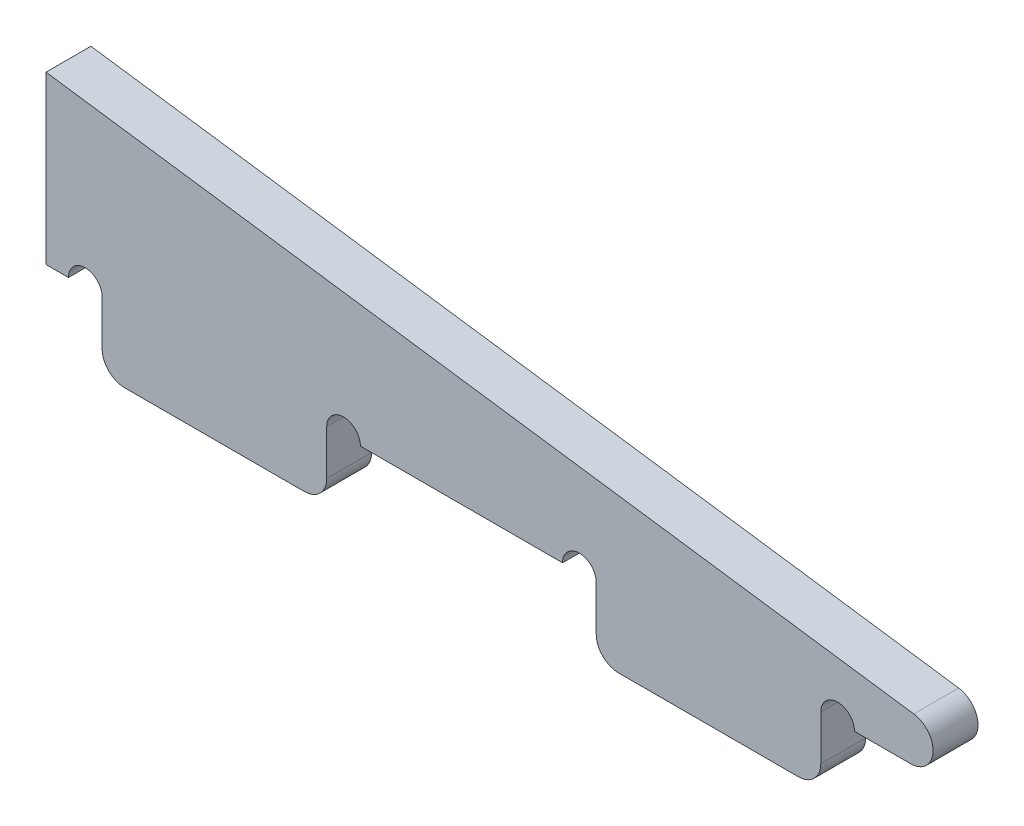
from build123d import *

# Parameters (mm, degrees)
EXTRUDE_1_DEPTH     = 2
SKETCH_2_R          = 0.75
CUT_EXTRUDE_1_DEPTH = 36.34566511
FILLET_1_R          = 1


with BuildPart() as part:
    # 草图1 → 凸台-拉伸1 (new body)
    with BuildSketch(Plane.XY):
        with BuildLine():
            Line((4.139173101, 1.990268069), (-34.5, 7.420649709))
            Line((-34.5, 7.420649709), (-34.5, 0))
            Line((-34.5, 0), (-32, 0))
            Line((-32, 0), (-32, -3))
            Line((-32, -3), (-22, -3))
            Line((-22, -3), (-22, 0))
            Line((-22, 0), (-10, 0))
            Line((-10, 0), (-10, -3))
            Line((-10, -3), (0, -3))
            Line((0, -3), (0, 0))
            Line((0, 0), (4, 0))
            ThreePointArc((4, 0), (4.99756405, 0.930243526), (4.139173101, 1.990268069))
        make_face()
    extrude(amount=EXTRUDE_1_DEPTH)

    # 草图2 → 切除-拉伸1 (cut, through all)
    with BuildSketch(Plane.XY.offset(2)):
        with Locations((-32.75, 0)):
            Circle(SKETCH_2_R)
        with Locations((-21.25, 0)):
            Circle(SKETCH_2_R)
        with Locations((-10.75, 0)):
            Circle(SKETCH_2_R)
        with Locations((0.75, 0)):
            Circle(SKETCH_2_R)
    extrude(amount=-CUT_EXTRUDE_1_DEPTH, mode=Mode.SUBTRACT)

    # 圆角1
    fillet_1_edges = [part.edges().sort_by_distance(p)[0] for p in [
        (0, -3, 1),
        (-10, -3, 1),
        (-22, -3, 1),
        (-32, -3, 1),
    ]]
    fillet(fillet_1_edges, radius=FILLET_1_R)


solid = part.part
